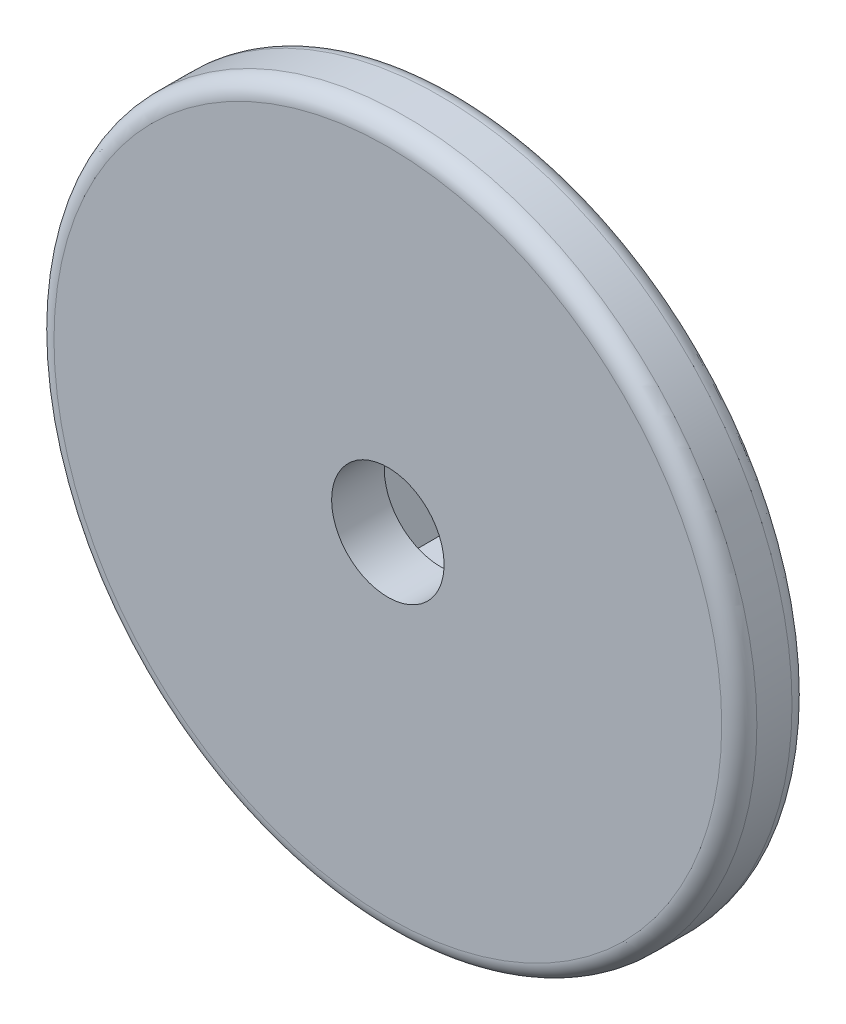
from build123d import *

# Parameters (mm, degrees)
SKETCH2_R          = 1.6
CUT_EXTRUDE1_DEPTH = 15.568802353
CUT_EXTRUDE2_DEPTH = 2


with BuildPart() as part:
    # Sketch1 → Revolve1 (revolve)
    with BuildSketch(Plane(origin=(0, 0, 0), x_dir=(1, 0, 0), z_dir=(0, 1, 0)), mode=Mode.PRIVATE) as revolve1_sk:
        with BuildLine():
            Line((0, 0), (9.5, 0))
            ThreePointArc((9.5, 0), (9.853553391, 0.146446609), (10, 0.5))
            Line((10, 0.5), (10, 1.5))
            ThreePointArc((10, 1.5), (9.853553391, 1.853553391), (9.5, 2))
            Line((9.5, 2), (7, 2))
            Line((7, 2), (6.192982456, 4))
            Line((6.192982456, 4), (4.692982456, 4))
            Line((4.692982456, 4), (4.035087719, 3.5))
            Line((4.035087719, 3.5), (0, 3.5))
            Line((0, 3.5), (0, 0))
        make_face()
    revolve(revolve1_sk.sketch.rotate(Axis((0, 0, -3.5), (0, 0, 1)), 180), axis=Axis((0, 0, -3.5), (0, 0, 1)))

    # Sketch2 → Cut-Extrude1 (cut, through all)
    with BuildSketch(Plane(origin=(0, 0, -3.5), x_dir=(-1, 0, 0), z_dir=(0, 0, -1))):
        Circle(SKETCH2_R)
    extrude(amount=-CUT_EXTRUDE1_DEPTH, mode=Mode.SUBTRACT)

    # Sketch3 → Cut-Extrude2 (cut)
    with BuildSketch(Plane(origin=(0, 0, -3.5), x_dir=(-1, 0, 0), z_dir=(0, 0, -1))):
        Polygon((-1.356166015, -2.807278707), (1.753091669, -2.578113574), (3.109257683, 0.229165133), (1.356166015, 2.807278707), (-1.753091669, 2.578113574), (-3.109257683, -0.229165133), align=None)
    extrude(amount=-CUT_EXTRUDE2_DEPTH, mode=Mode.SUBTRACT)


solid = part.part
